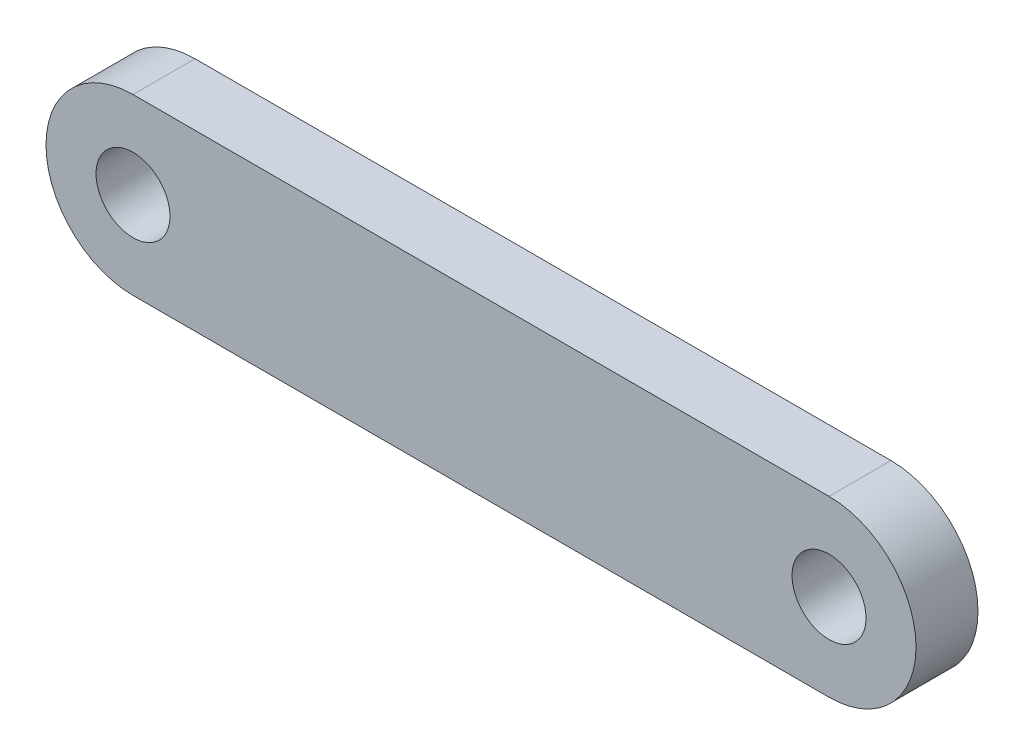
from build123d import *

# Parameters (mm, degrees)
SKETCH1_W           = 40
SKETCH1_H           = 8
BOSS_EXTRUDE1_DEPTH = 2.85
CUT_EXTRUDE1_DEPTH  = 21.59423463
SKETCH3_R           = 1.7
CUT_EXTRUDE2_DEPTH  = 21.59423463


with BuildPart() as part:
    # Sketch1 → Boss-Extrude1 (new body)
    with BuildSketch(Plane.XY):
        Rectangle(SKETCH1_W, SKETCH1_H)
    extrude(amount=BOSS_EXTRUDE1_DEPTH)

    # Sketch2 → Cut-Extrude1 (cut, through all)
    with BuildSketch(Plane.XY.offset(2.85)):
        with BuildLine():
            Line((16, -4), (21, -4))
            Line((21, -4), (21, 4))
            Line((21, 4), (16, 4))
            ThreePointArc((16, 4), (20, 0), (16, -4))
        make_face()
    cut_extrude1 = extrude(amount=-CUT_EXTRUDE1_DEPTH, mode=Mode.SUBTRACT)

    # Sketch3 → Cut-Extrude2 (cut, through all)
    with BuildSketch(Plane.XY.offset(2.85)):
        with Locations((16, 0)):
            Circle(SKETCH3_R)
    cut_extrude2 = extrude(amount=-CUT_EXTRUDE2_DEPTH, mode=Mode.SUBTRACT)

    # Mirror1: Cut-Extrude1, Cut-Extrude2 across plane
    add(cut_extrude1.mirror(Plane(origin=(0, 0, 0), x_dir=(0, 0, 1), z_dir=(1, 0, 0))), mode=Mode.SUBTRACT)
    add(cut_extrude2.mirror(Plane(origin=(0, 0, 0), x_dir=(0, 0, 1), z_dir=(1, 0, 0))), mode=Mode.SUBTRACT)


solid = part.part
